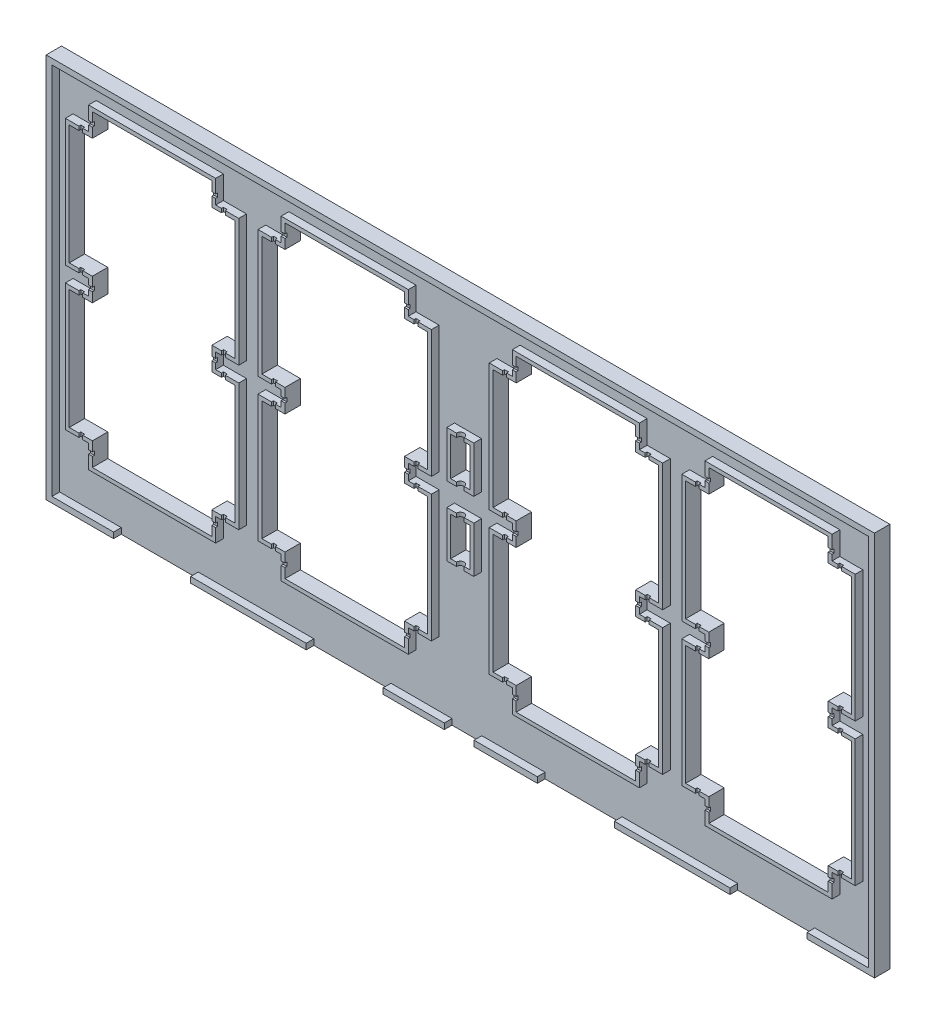
from build123d import *

# Parameters (mm, degrees)
SKETCH_1_W           = 210
SKETCH_1_H           = 100
EXTRUDE_1_DEPTH      = 2
CUT_EXTRUDE_1_DEPTH  = 2
SKETCH_3_W           = 5
SKETCH_3_H           = 10
CUT_EXTRUDE_2_DEPTH  = 2
EXTRUDE_3_DEPTH      = 2
EXTRUDE_4_DEPTH      = 2
SKETCH_7_W           = 2.5
SKETCH_7_H           = 100
EXTRUDE_5_DEPTH      = 2
SKETCH_8_W           = 2.5
SKETCH_8_H           = 100
EXTRUDE_6_DEPTH      = 2
SKETCH_9_W           = 7
SKETCH_9_H           = 12
SKETCH_9_W_2         = 5
SKETCH_9_H_2         = 10
EXTRUDE_7_DEPTH      = 2
SKETCH_10_W          = 7
SKETCH_10_H          = 12
SKETCH_10_W_2        = 5
SKETCH_10_H_2        = 10
EXTRUDE_8_DEPTH      = 2
EXTRUDE_9_DEPTH      = 2
EXTRUDE_10_DEPTH     = 2
SKETCH_13_W          = 215
SKETCH_13_H          = 100
SKETCH_13_W_2        = 212
SKETCH_13_H_2        = 97
EXTRUDE_12_DEPTH     = 2
CUT_EXTRUDE_5_DEPTH  = 0.5
CUT_EXTRUDE_6_DEPTH  = 0.5
SKETCH_18_R          = 1
CUT_EXTRUDE_8_DEPTH  = 40
CUT_EXTRUDE_9_DEPTH  = 0.5
CUT_EXTRUDE_10_DEPTH = 0.5
CUT_EXTRUDE_11_DEPTH = 0.5
CUT_EXTRUDE_12_DEPTH = 0.5
CUT_EXTRUDE_13_DEPTH = 0.5
CUT_EXTRUDE_14_DEPTH = 0.5
CUT_EXTRUDE_15_DEPTH = 0.5
CUT_EXTRUDE_16_DEPTH = 0.5
CUT_EXTRUDE_17_DEPTH = 0.5
SKETCH_28_W          = 20
SKETCH_28_H          = 5.141542118
CUT_EXTRUDE_18_DEPTH = 2
SKETCH_29_W          = 7.735250041
SKETCH_29_H          = 4.76830482
CUT_EXTRUDE_19_DEPTH = 2


with BuildPart() as part:
    # Эскиз1 → Бобышка-Вытянуть1 (new body)
    with BuildSketch(Plane.XY):
        with Locations((105, 50)):
            Rectangle(SKETCH_1_W, SKETCH_1_H)
    extrude(amount=EXTRUDE_1_DEPTH)

    # Эскиз2 → Вырез-Вытянуть1 (cut)
    with BuildSketch(Plane.XY.offset(2)):
        Polygon((3.5, 56.25158028), (9.5, 56.25158028), (9.5, 50.25158028), (3.5, 50.25158028), (3.5, 19.25158028), (9.5, 19.25158028), (9.5, 13.25158028), (40.5, 13.25158028), (40.5, 19.25158028), (46.5, 19.25158028), (46.5, 50.25158028), (40.5, 50.25158028), (40.5, 56.25158028), (46.5, 56.25158028), (46.5, 87.25158028), (40.5, 87.25158028), (40.5, 93.25158028), (9.5, 93.25158028), (9.5, 87.25158028), (3.5, 87.25158028), align=None)
        Polygon((53.5, 56.25158028), (59.5, 56.25158028), (59.5, 50.25158028), (53.5, 50.25158028), (53.5, 19.25158028), (59.5, 19.25158028), (59.5, 13.25158028), (90.5, 13.25158028), (90.5, 19.25158028), (96.5, 19.25158028), (96.5, 50.25158028), (90.5, 50.25158028), (90.5, 56.25158028), (96.5, 56.25158028), (96.5, 87.25158028), (90.5, 87.25158028), (90.5, 93.25158028), (59.5, 93.25158028), (59.5, 87.25158028), (53.5, 87.25158028), align=None)
        Polygon((113.5, 56.25158028), (119.5, 56.25158028), (119.5, 50.25158028), (113.5, 50.25158028), (113.5, 19.25158028), (119.5, 19.25158028), (119.5, 13.25158028), (150.5, 13.25158028), (150.5, 19.25158028), (156.5, 19.25158028), (156.5, 50.25158028), (150.5, 50.25158028), (150.5, 56.25158028), (156.5, 56.25158028), (156.5, 87.25158028), (150.5, 87.25158028), (150.5, 93.25158028), (119.5, 93.25158028), (119.5, 87.25158028), (113.5, 87.25158028), align=None)
        Polygon((163.5, 56.25158028), (169.5, 56.25158028), (169.5, 50.25158028), (163.5, 50.25158028), (163.5, 19.25158028), (169.5, 19.25158028), (169.5, 13.25158028), (200.5, 13.25158028), (200.5, 19.25158028), (206.5, 19.25158028), (206.5, 50.25158028), (200.5, 50.25158028), (200.5, 56.25158028), (206.5, 56.25158028), (206.5, 87.25158028), (200.5, 87.25158028), (200.5, 93.25158028), (169.5, 93.25158028), (169.5, 87.25158028), (163.5, 87.25158028), align=None)
    extrude(amount=-CUT_EXTRUDE_1_DEPTH, mode=Mode.SUBTRACT)

    # Эскиз3 → Вырез-Вытянуть2 (cut)
    with BuildSketch(Plane.XY.offset(2)):
        with Locations((105, 62.25158028)):
            Rectangle(SKETCH_3_W, SKETCH_3_H)
        with Locations((105, 44.25158028)):
            Rectangle(SKETCH_3_W, SKETCH_3_H)
    extrude(amount=-CUT_EXTRUDE_2_DEPTH, mode=Mode.SUBTRACT)

    # Эскиз5 → Бобышка-Вытянуть3 (add)
    with BuildSketch(Plane.XY.offset(2)):
        Polygon((8.5, 88.25158028), (8.5, 94.25158028), (41.5, 94.25158028), (41.5, 88.25158028), (47.5, 88.25158028), (47.5, 55.25158028), (41.5, 55.25158028), (41.5, 51.25158028), (47.5, 51.25158028), (47.5, 18.25158028), (41.5, 18.25158028), (41.5, 12.25158028), (8.5, 12.25158028), (8.5, 18.25158028), (2.5, 18.25158028), (2.5, 51.25158028), (8.5, 51.25158028), (8.5, 55.25158028), (2.5, 55.25158028), (2.5, 88.25158028), align=None)
        Polygon((9.5, 93.25158028), (40.5, 93.25158028), (40.5, 87.25158028), (46.5, 87.25158028), (46.5, 56.25158028), (40.5, 56.25158028), (40.5, 50.25158028), (46.5, 50.25158028), (46.5, 19.25158028), (40.5, 19.25158028), (40.5, 13.25158028), (9.5, 13.25158028), (9.5, 19.25158028), (3.5, 19.25158028), (3.5, 50.25158028), (9.5, 50.25158028), (9.5, 56.25158028), (3.5, 56.25158028), (3.5, 87.25158028), (9.5, 87.25158028), align=None, mode=Mode.SUBTRACT)
    extrude(amount=EXTRUDE_3_DEPTH)

    # Эскиз6 → Бобышка-Вытянуть4 (add)
    with BuildSketch(Plane.XY.offset(2)):
        Polygon((58.5, 88.25158028), (58.5, 94.25158028), (91.5, 94.25158028), (91.5, 88.25158028), (97.5, 88.25158028), (97.5, 55.25158028), (91.5, 55.25158028), (91.5, 51.25158028), (97.5, 51.25158028), (97.5, 18.25158028), (91.5, 18.25158028), (91.5, 12.25158028), (58.5, 12.25158028), (58.5, 18.25158028), (52.5, 18.25158028), (52.5, 51.25158028), (58.5, 51.25158028), (58.5, 55.25158028), (52.5, 55.25158028), (52.5, 88.25158028), align=None)
        Polygon((59.5, 93.25158028), (90.5, 93.25158028), (90.5, 87.25158028), (96.5, 87.25158028), (96.5, 56.25158028), (90.5, 56.25158028), (90.5, 50.25158028), (96.5, 50.25158028), (96.5, 19.25158028), (90.5, 19.25158028), (90.5, 13.25158028), (59.5, 13.25158028), (59.5, 19.25158028), (53.5, 19.25158028), (53.5, 50.25158028), (59.5, 50.25158028), (59.5, 56.25158028), (53.5, 56.25158028), (53.5, 87.25158028), (59.5, 87.25158028), align=None, mode=Mode.SUBTRACT)
    extrude(amount=EXTRUDE_4_DEPTH)

    # Эскиз7 → Бобышка-Вытянуть5 (add)
    with BuildSketch(Plane.XY.offset(2)):
        with Locations((-1.25, 50)):
            Rectangle(SKETCH_7_W, SKETCH_7_H)
    extrude(amount=-EXTRUDE_5_DEPTH)

    # Эскиз8 → Бобышка-Вытянуть6 (add)
    with BuildSketch(Plane.XY.offset(2)):
        with Locations((211.25, 50)):
            Rectangle(SKETCH_8_W, SKETCH_8_H)
    extrude(amount=-EXTRUDE_6_DEPTH)

    # Эскиз9 → Бобышка-Вытянуть7 (add)
    with BuildSketch(Plane.XY.offset(2)):
        with Locations((105, 62.25158028)):
            Rectangle(SKETCH_9_W, SKETCH_9_H)
        with Locations((105, 62.25158028)):
            Rectangle(SKETCH_9_W_2, SKETCH_9_H_2, mode=Mode.SUBTRACT)
    extrude(amount=EXTRUDE_7_DEPTH)

    # Эскиз10 → Бобышка-Вытянуть8 (add)
    with BuildSketch(Plane.XY.offset(2)):
        with Locations((105, 44.25158028)):
            Rectangle(SKETCH_10_W, SKETCH_10_H)
        with Locations((105, 44.25158028)):
            Rectangle(SKETCH_10_W_2, SKETCH_10_H_2, mode=Mode.SUBTRACT)
    extrude(amount=EXTRUDE_8_DEPTH)

    # Эскиз11 → Бобышка-Вытянуть9 (add)
    with BuildSketch(Plane.XY.offset(2)):
        Polygon((118.5, 88.25158028), (118.5, 94.25158028), (151.5, 94.25158028), (151.5, 88.25158028), (157.5, 88.25158028), (157.5, 55.25158028), (151.5, 55.25158028), (151.5, 51.25158028), (157.5, 51.25158028), (157.5, 18.25158028), (151.5, 18.25158028), (151.5, 12.25158028), (118.5, 12.25158028), (118.5, 18.25158028), (112.5, 18.25158028), (112.5, 51.25158028), (118.5, 51.25158028), (118.5, 55.25158028), (112.5, 55.25158028), (112.5, 88.25158028), align=None)
        Polygon((119.5, 93.25158028), (150.5, 93.25158028), (150.5, 87.25158028), (156.5, 87.25158028), (156.5, 56.25158028), (150.5, 56.25158028), (150.5, 50.25158028), (156.5, 50.25158028), (156.5, 19.25158028), (150.5, 19.25158028), (150.5, 13.25158028), (119.5, 13.25158028), (119.5, 19.25158028), (113.5, 19.25158028), (113.5, 50.25158028), (119.5, 50.25158028), (119.5, 56.25158028), (113.5, 56.25158028), (113.5, 87.25158028), (119.5, 87.25158028), align=None, mode=Mode.SUBTRACT)
    extrude(amount=EXTRUDE_9_DEPTH)

    # Эскиз12 → Бобышка-Вытянуть10 (add)
    with BuildSketch(Plane.XY.offset(2)):
        Polygon((168.5, 88.25158028), (168.5, 94.25158028), (201.5, 94.25158028), (201.5, 88.25158028), (207.5, 88.25158028), (207.5, 55.25158028), (201.5, 55.25158028), (201.5, 51.25158028), (207.5, 51.25158028), (207.5, 18.25158028), (201.5, 18.25158028), (201.5, 12.25158028), (168.5, 12.25158028), (168.5, 18.25158028), (162.5, 18.25158028), (162.5, 51.25158028), (168.5, 51.25158028), (168.5, 55.25158028), (162.5, 55.25158028), (162.5, 88.25158028), align=None)
        Polygon((169.5, 93.25158028), (200.5, 93.25158028), (200.5, 87.25158028), (206.5, 87.25158028), (206.5, 56.25158028), (200.5, 56.25158028), (200.5, 50.25158028), (206.5, 50.25158028), (206.5, 19.25158028), (200.5, 19.25158028), (200.5, 13.25158028), (169.5, 13.25158028), (169.5, 19.25158028), (163.5, 19.25158028), (163.5, 50.25158028), (169.5, 50.25158028), (169.5, 56.25158028), (163.5, 56.25158028), (163.5, 87.25158028), (169.5, 87.25158028), align=None, mode=Mode.SUBTRACT)
    extrude(amount=EXTRUDE_10_DEPTH)

    # Эскиз13 → Бобышка-Вытянуть12 (add)
    with BuildSketch(Plane.XY.offset(2)):
        with Locations((105, 50)):
            Rectangle(SKETCH_13_W, SKETCH_13_H)
        with Locations((105, 50)):
            Rectangle(SKETCH_13_W_2, SKETCH_13_H_2, mode=Mode.SUBTRACT)
    extrude(amount=EXTRUDE_12_DEPTH)

    # Эскиз15 → Вырез-Вытянуть5 (cut)
    with BuildSketch(Plane.XY.offset(4)):
        Polygon((7, 87.846695126), (7, 16.428250705), (6, 16.428250705), (6, 89.715353261), (7, 89.715353261), align=None)
    extrude(amount=-CUT_EXTRUDE_5_DEPTH, mode=Mode.SUBTRACT)

    # Эскиз16 → Вырез-Вытянуть6 (cut)
    with BuildSketch(Plane.XY.offset(4)):
        Polygon((9.5, 53.75158028), (207.235738324, 53.75158028), (207.235738324, 52.75158028), (7.033108755, 52.75158028), (7.033108755, 53.75158028), align=None)
    extrude(amount=-CUT_EXTRUDE_6_DEPTH, mode=Mode.SUBTRACT)

    # Эскиз18 → Вырез-Вытянуть8 (cut)
    with BuildSketch(Plane.XZ.offset(-38.25158028)):
        with Locations((105, 4)):
            Circle(SKETCH_18_R)
    extrude(amount=-CUT_EXTRUDE_8_DEPTH, mode=Mode.SUBTRACT)

    # Эскиз19 → Вырез-Вытянуть9 (cut)
    with BuildSketch(Plane.XY.offset(4)):
        Polygon((9.5, 16.75158028), (205.637089943, 16.75158028), (205.637089943, 15.75158028), (6.346061877, 15.75158028), (6.346061877, 16.75158028), align=None)
    extrude(amount=-CUT_EXTRUDE_9_DEPTH, mode=Mode.SUBTRACT)

    # Эскиз20 → Вырез-Вытянуть10 (cut)
    with BuildSketch(Plane.XY.offset(4)):
        Polygon((9.5, 90.75158028), (205.985832095, 90.75158028), (205.985832095, 89.75158028), (6.902004975, 89.75158028), (6.902004975, 90.75158028), align=None)
    extrude(amount=-CUT_EXTRUDE_10_DEPTH, mode=Mode.SUBTRACT)

    # Эскиз21 → Вырез-Вытянуть11 (cut)
    with BuildSketch(Plane.XY.offset(4)):
        Polygon((44, 87.25158028), (44, 14.66925504), (43, 14.66925504), (43, 89.404001718), (44, 89.404001718), align=None)
    extrude(amount=-CUT_EXTRUDE_11_DEPTH, mode=Mode.SUBTRACT)

    # Эскиз22 → Вырез-Вытянуть12 (cut)
    with BuildSketch(Plane.XY.offset(4)):
        Polygon((57, 87.25158028), (57, 16.867025175), (56, 16.867025175), (56, 91.235802404), (57, 91.235802404), align=None)
    extrude(amount=-CUT_EXTRUDE_12_DEPTH, mode=Mode.SUBTRACT)

    # Эскиз23 → Вырез-Вытянуть13 (cut)
    with BuildSketch(Plane.XY.offset(4)):
        Polygon((94, 19.25158028), (94, 90.827406377), (93, 90.827406377), (93, 16.223092633), (94, 16.223092633), align=None)
    extrude(amount=-CUT_EXTRUDE_13_DEPTH, mode=Mode.SUBTRACT)

    # Эскиз24 → Вырез-Вытянуть14 (cut)
    with BuildSketch(Plane.XY.offset(4)):
        Polygon((116, 19.25158028), (116, 17.281770107), (117, 17.281770107), (117, 91.111451252), (116, 91.111451252), align=None)
    extrude(amount=-CUT_EXTRUDE_14_DEPTH, mode=Mode.SUBTRACT)

    # Эскиз25 → Вырез-Вытянуть15 (cut)
    with BuildSketch(Plane.XY.offset(4)):
        Polygon((154, 19.25158028), (154, 16.478696583), (153, 16.478696583), (153, 93.52809477), (154, 93.52809477), align=None)
    extrude(amount=-CUT_EXTRUDE_15_DEPTH, mode=Mode.SUBTRACT)

    # Эскиз26 → Вырез-Вытянуть16 (cut)
    with BuildSketch(Plane.XY.offset(4)):
        Polygon((167, 87.25158028), (167, 89.746112194), (166, 89.746112194), (166, 15.475937203), (167, 15.475937203), align=None)
    extrude(amount=-CUT_EXTRUDE_16_DEPTH, mode=Mode.SUBTRACT)

    # Эскиз27 → Вырез-Вытянуть17 (cut)
    with BuildSketch(Plane.XY.offset(4)):
        Polygon((204, 19.25158028), (204, 15.504103959), (203, 15.504103959), (203, 91.252841114), (204, 91.252841114), align=None)
    extrude(amount=-CUT_EXTRUDE_17_DEPTH, mode=Mode.SUBTRACT)

    # Эскиз28 → Вырез-Вытянуть18 (cut)
    with BuildSketch(Plane.XY.offset(2)):
        with Locations((25, 0.992347307)):
            Rectangle(SKETCH_28_W, SKETCH_28_H)
        with Locations((75, 0.992347307)):
            Rectangle(SKETCH_28_W, SKETCH_28_H)
        with Locations((135, 0.992347307)):
            Rectangle(SKETCH_28_W, SKETCH_28_H)
        with Locations((185, 0.992347307)):
            Rectangle(SKETCH_28_W, SKETCH_28_H)
    extrude(amount=CUT_EXTRUDE_18_DEPTH, mode=Mode.SUBTRACT)

    # Эскиз29 → Вырез-Вытянуть19 (cut)
    with BuildSketch(Plane.XY.offset(2)):
        with Locations((104.718144824, 0.7951442)):
            Rectangle(SKETCH_29_W, SKETCH_29_H)
    extrude(amount=CUT_EXTRUDE_19_DEPTH, mode=Mode.SUBTRACT)


solid = part.part
